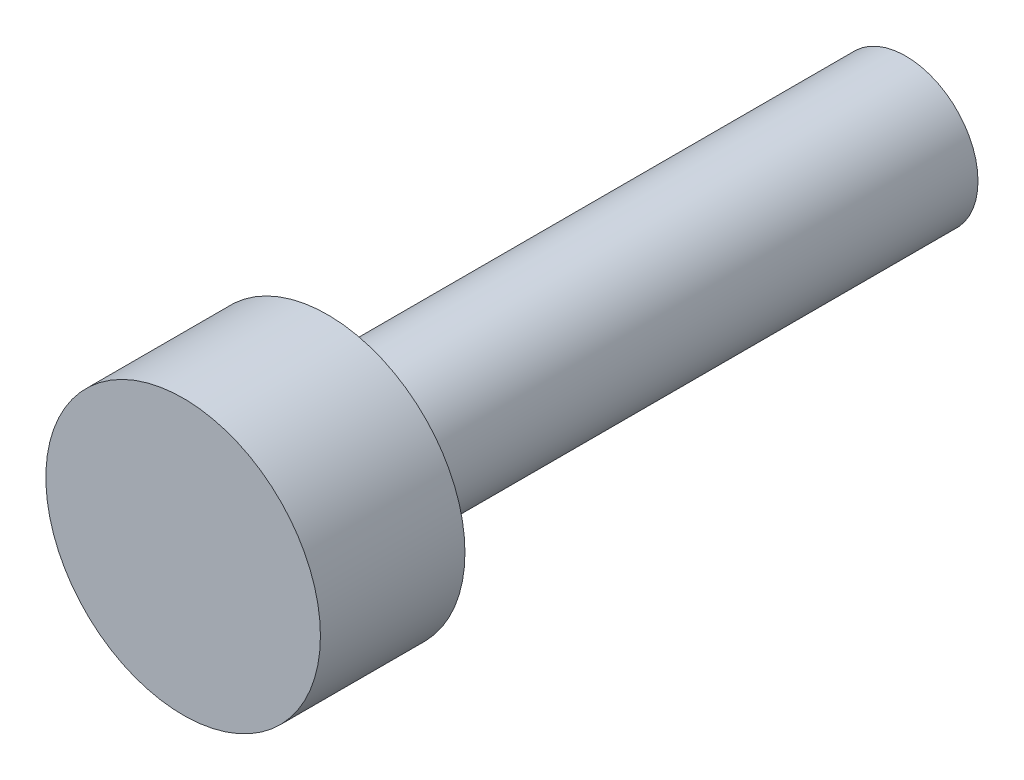
from build123d import *

# Parameters (mm, degrees)
SKETCH1_R           = 1.5
BOSS_EXTRUDE1_DEPTH = 12
SKETCH2_R           = 2.85
BOSS_EXTRUDE2_DEPTH = 3


with BuildPart() as part:
    # Sketch1 → Boss-Extrude1 (new body)
    with BuildSketch(Plane.XY):
        Circle(SKETCH1_R)
    extrude(amount=BOSS_EXTRUDE1_DEPTH)

    # Sketch2 → Boss-Extrude2 (add)
    with BuildSketch(Plane.XY.offset(12)):
        Circle(SKETCH2_R)
    extrude(amount=BOSS_EXTRUDE2_DEPTH)


solid = part.part
